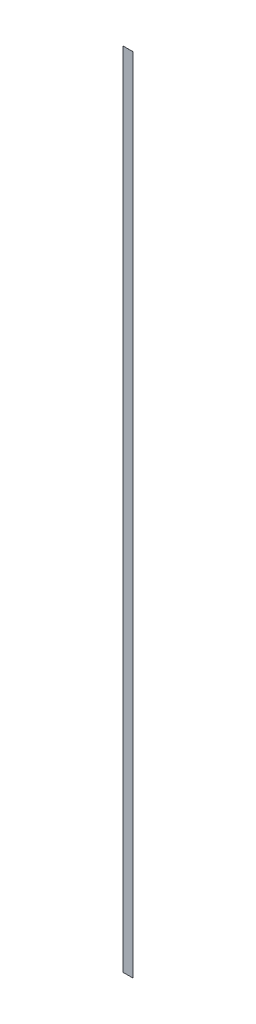
from build123d import *

# Parameters (mm, degrees)
SCHIZZO1_W                   = 3000
SCHIZZO1_H                   = 250000
ESTRUSIONE_ESTRUSIONE1_DEPTH = 15


with BuildPart() as part:
    # Schizzo1 → Estrusione-Estrusione1 (new body)
    with BuildSketch(Plane.XY):
        with Locations((-1500, 125000)):
            Rectangle(SCHIZZO1_W, SCHIZZO1_H)
    extrude(amount=ESTRUSIONE_ESTRUSIONE1_DEPTH)


solid = part.part
